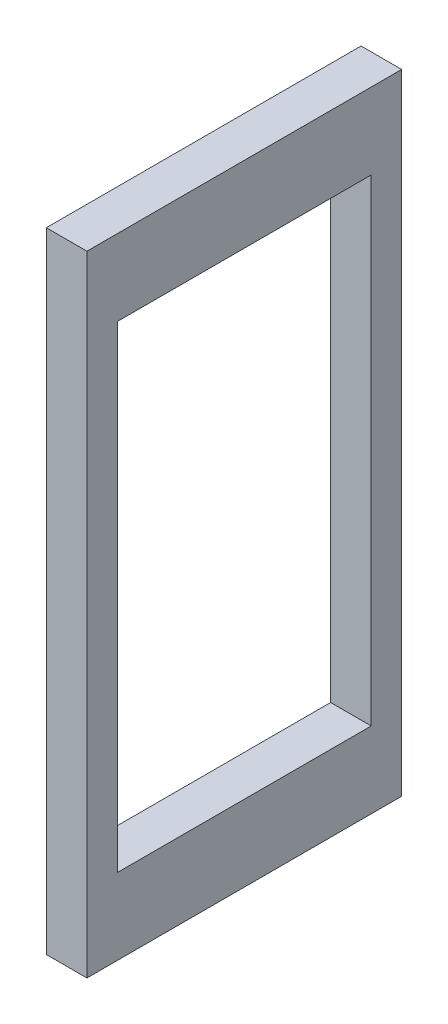
from build123d import *

# Parameters (mm, degrees)
SKETCH1_W           = 23.5
SKETCH1_H           = 12.5
BOSS_EXTRUDE1_DEPTH = 2


with BuildPart() as part:
    # Sketch1 → Boss-Extrude1 (new body)
    with BuildSketch(Plane.YZ):
        Polygon((15.84119162, -7.151864849), (15.84119162, -8.348913545), (-15.15732803, -8.348913545), (-15.15732803, -6.848913545), (-15.15732803, 5.651086455), (-15.15732803, 7.151086455), (15.84119162, 7.151086455), (15.84119162, 6.848135151), align=None)
        with Locations((0.341931795, -0.598913545)):
            Rectangle(SKETCH1_W, SKETCH1_H, mode=Mode.SUBTRACT)
    extrude(amount=BOSS_EXTRUDE1_DEPTH)


solid = part.part
